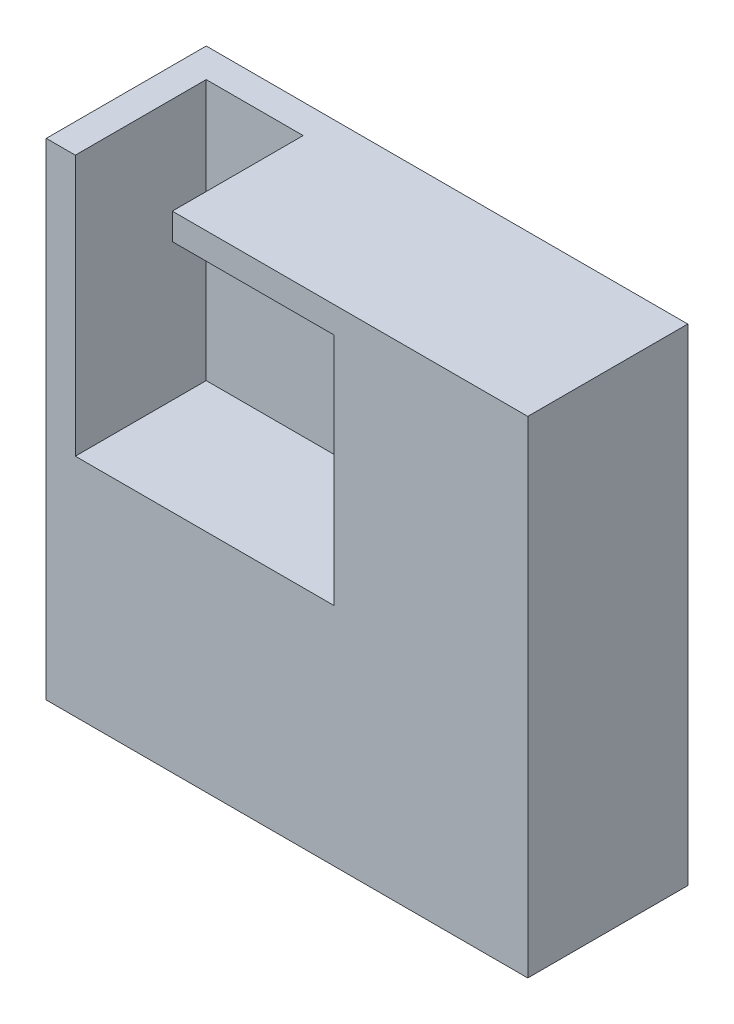
from build123d import *

# Parameters (mm, degrees)
SKETCH1_W           = 29.8
SKETCH1_H           = 30.1
BOSS_EXTRUDE1_DEPTH = 9.9
CUT_EXTRUDE1_DEPTH  = 8.1
SKETCH3_R           = 2.8
CUT_EXTRUDE2_DEPTH  = 44.123775345


with BuildPart() as part:
    # Sketch1 → Boss-Extrude1 (new body)
    with BuildSketch(Plane.XY):
        with Locations((14.9, 15.05)):
            Rectangle(SKETCH1_W, SKETCH1_H)
    extrude(amount=BOSS_EXTRUDE1_DEPTH)

    # Sketch2 → Cut-Extrude1 (cut)
    with BuildSketch(Plane.XY.offset(9.9)):
        Polygon((7.8, 30.1), (7.8, 28.466915374), (17.8, 28.466915374), (17.8, 13.966915374), (1.8, 13.966915374), (1.8, 28.466915374), (1.8, 30.1), align=None)
    extrude(amount=-CUT_EXTRUDE1_DEPTH, mode=Mode.SUBTRACT)

    # Sketch3 → Cut-Extrude2 (cut, through all)
    with BuildSketch(Plane.XY.offset(1.8)):
        with Locations((14.3, 17.466915374)):
            Circle(SKETCH3_R)
    extrude(amount=-CUT_EXTRUDE2_DEPTH, mode=Mode.SUBTRACT)


solid = part.part
